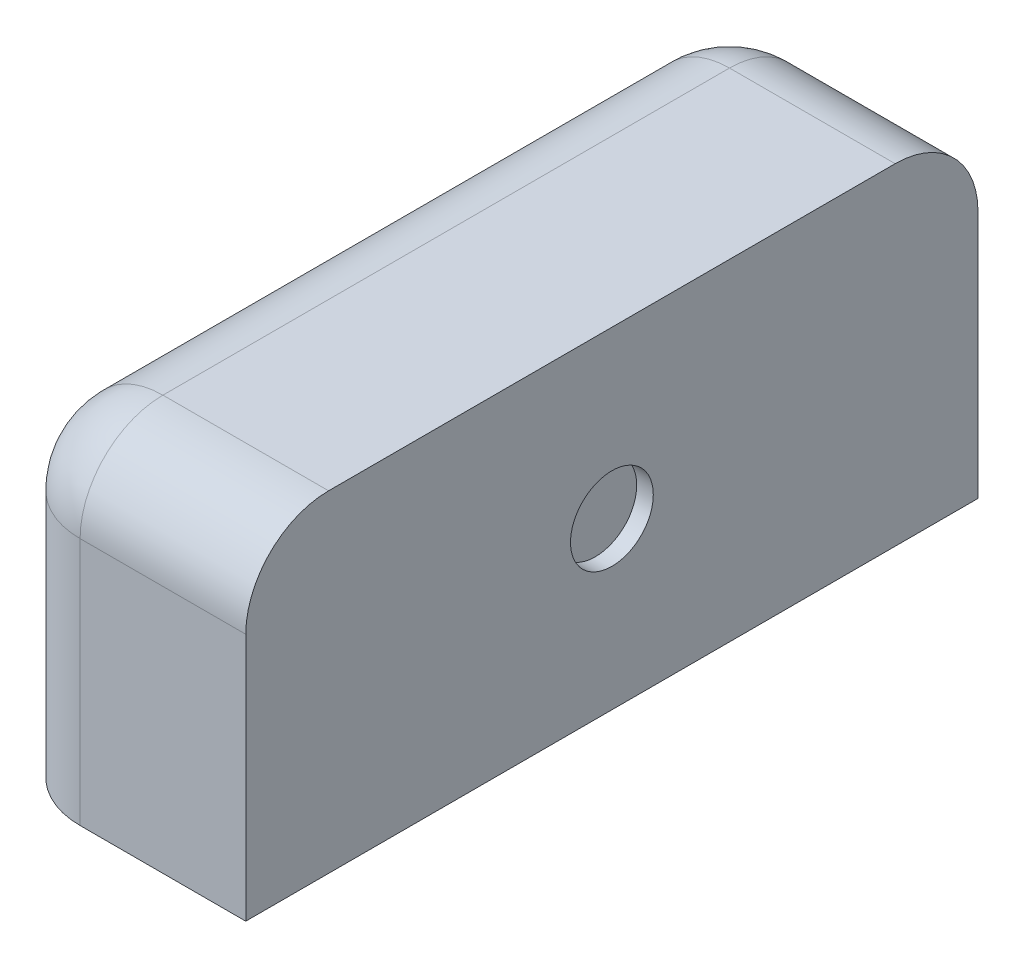
from build123d import *

# Parameters (mm, degrees)
SKETCH1_W           = 30
SKETCH1_H           = 88.4
BOSS_EXTRUDE1_DEPTH = 40
FILLET1_R           = 10
SKETCH2_R           = 5
CUT_EXTRUDE1_DEPTH  = 2


with BuildPart() as part:
    # Sketch1 → Boss-Extrude1 (new body)
    with BuildSketch(Plane(origin=(0, 0, 0), x_dir=(1, 0, 0), z_dir=(0, 1, 0))):
        with Locations((15, 44.2)):
            Rectangle(SKETCH1_W, SKETCH1_H)
    extrude(amount=BOSS_EXTRUDE1_DEPTH)

    # Fillet1
    fillet1_edges = [part.edges().sort_by_distance(p)[0] for p in [
        (15, 40, -88.4),
        (0, 40, -44.2),
        (0, 20, -88.4),
        (0, 20, 0),
        (15, 40, 0),
    ]]
    fillet(fillet1_edges, radius=FILLET1_R)

    # Sketch2 → Cut-Extrude1 (cut)
    with BuildSketch(Plane(origin=(30, 0, 0), x_dir=(0, 0, -1), z_dir=(1, 0, 0))):
        with Locations((44.2, 20)):
            Circle(SKETCH2_R)
    extrude(amount=-CUT_EXTRUDE1_DEPTH, mode=Mode.SUBTRACT)


solid = part.part
